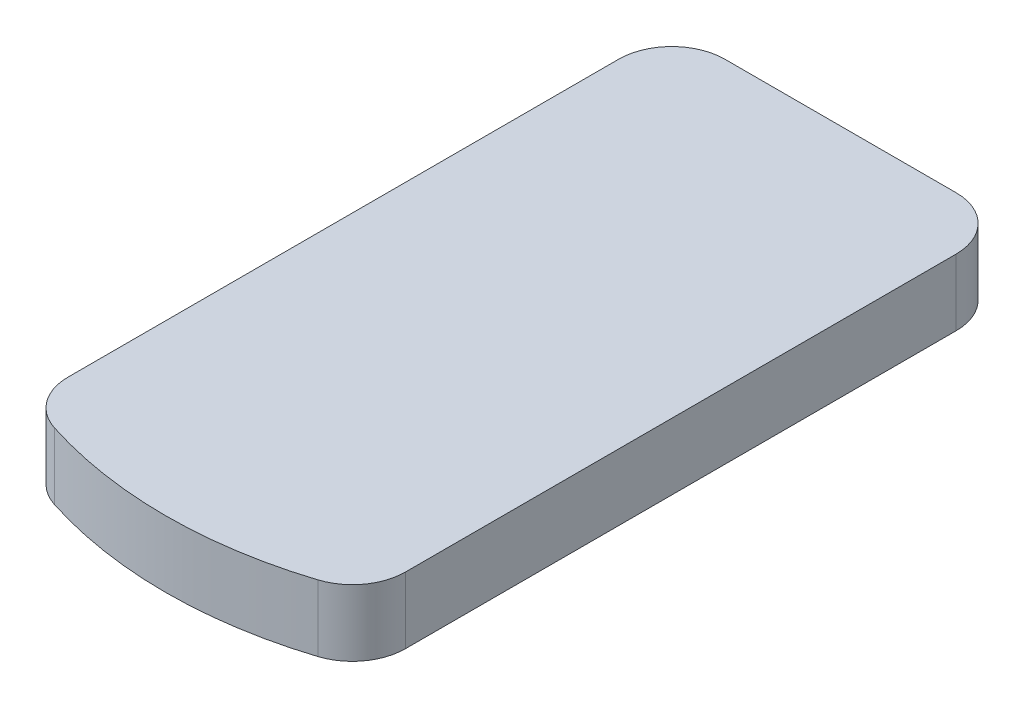
from build123d import *

# Parameters (mm, degrees)
CROQUIS1_W              = 63.5
CROQUIS1_H              = 12.5
SALIENTE_EXTRUIR1_DEPTH = 127
CORTAR_EXTRUIR1_DEPTH   = 127
REDONDEO1_R             = 10


with BuildPart() as part:
    # Croquis1 → Saliente-Extruir1 (new body)
    with BuildSketch(Plane.XY):
        Rectangle(CROQUIS1_W, CROQUIS1_H)
    extrude(amount=SALIENTE_EXTRUIR1_DEPTH)

    # Croquis2 → Cortar-Extruir1 (cut)
    with BuildSketch(Plane(origin=(0, 6.25, 0), x_dir=(1, 0, 0), z_dir=(0, 1, 0))):
        with BuildLine():
            ThreePointArc((0, -127), (-16.200333365, -125.368441446), (-31.75, -120.539295353))
            Line((-31.75, -120.539295353), (-31.75, -127))
            Line((-31.75, -127), (0, -127))
        make_face()
        with BuildLine():
            ThreePointArc((31.75, -120.539295353), (16.200333365, -125.368441446), (0, -127))
            Line((0, -127), (31.75, -127))
            Line((31.75, -127), (31.75, -120.539295353))
        make_face()
    extrude(amount=-CORTAR_EXTRUIR1_DEPTH, mode=Mode.SUBTRACT)

    # Redondeo1
    redondeo1_edges = [part.edges().sort_by_distance(p)[0] for p in [
        (-31.75, 0, 120.539295353),
        (31.75, 0, 120.539295353),
        (-31.75, 0, 0),
        (31.75, 0, 0),
    ]]
    fillet(redondeo1_edges, radius=REDONDEO1_R)


solid = part.part
